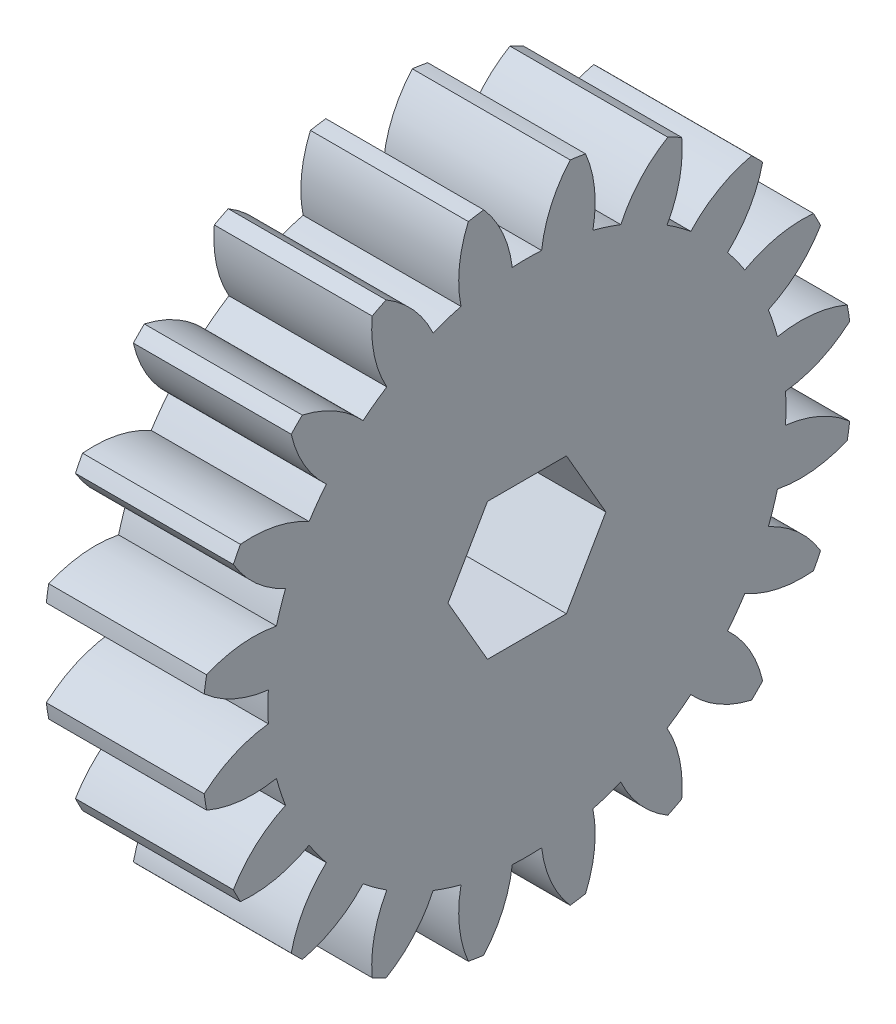
from build123d import *

# Parameters (mm, degrees)
BASPROSKE_W        = 8
BASPROSKE_H        = 16.5
TOOTHCUT_DEPTH     = 25.667792767
TEETHCUTS_COUNT    = 20
TEETHCUTS_ANGLE    = 342
BORSKE_R           = 2.5
BORE_DEPTH         = 50.0000508
CUT_EXTRUDE1_DEPTH = 25.472631648


with BuildPart() as part:
    # BasProSke → Base-Revolve (revolve)
    with BuildSketch(Plane(origin=(0, 0, 0), x_dir=(1, 0, 0), z_dir=(0, 1, 0)), mode=Mode.PRIVATE) as base_revolve_sk:
        with Locations((4, 8.25)):
            Rectangle(BASPROSKE_W, BASPROSKE_H)
    revolve(base_revolve_sk.sketch.rotate(Axis((-10, 0, 0), (1, 0, 0)), 180), axis=Axis((-10, 0, 0), (1, 0, 0)))

    # TooCutSke → ToothCut (cut, through all)
    with BuildSketch(Plane(origin=(0, 0, 0), x_dir=(0, 0, -1), z_dir=(1, 0, 0))):
        with BuildLine():
            ThreePointArc((0.74381438, 13.102904875), (0, 13.124), (-0.74381438, 13.102904875))
            ThreePointArc((-0.74381438, 13.102904875), (-1.226473103, 14.852072512), (-2.209965745, 16.376962373))
            ThreePointArc((-2.209965745, 16.376962373), (0, 16.5254), (2.209965745, 16.376962373))
            ThreePointArc((2.209965745, 16.376962373), (1.226473103, 14.852072512), (0.74381438, 13.102904875))
        make_face()
    toothcut = extrude(amount=TOOTHCUT_DEPTH, mode=Mode.SUBTRACT)

    # TeethCuts: ToothCut ×20 about axis
    teethcuts_axis = Axis((-10, 0, 0), (1, 0, 0))
    for i in range(1, TEETHCUTS_COUNT):
        add(toothcut.rotate(teethcuts_axis, i * TEETHCUTS_ANGLE / (TEETHCUTS_COUNT - 1)), mode=Mode.SUBTRACT)

    # BorSke → Bore (cut, symmetric)
    with BuildSketch(Plane(origin=(0, 0, 0), x_dir=(0, 0, -1), z_dir=(1, 0, 0))):
        with Locations(Location((0, 0, 0), (0, 0, 180))):
            Circle(BORSKE_R)
    extrude(amount=BORE_DEPTH, both=True, mode=Mode.SUBTRACT)

    # Sketch1 → Cut-Extrude1 (cut, through all)
    with BuildSketch(Plane(origin=(8, 0, 0), x_dir=(0, 0, -1), z_dir=(1, 0, 0))):
        Polygon((4, 0), (2, 3.464101615), (-2, 3.464101615), (-4, 0), (-2, -3.464101615), (2, -3.464101615), align=None)
    extrude(amount=-CUT_EXTRUDE1_DEPTH, mode=Mode.SUBTRACT)


solid = part.part
